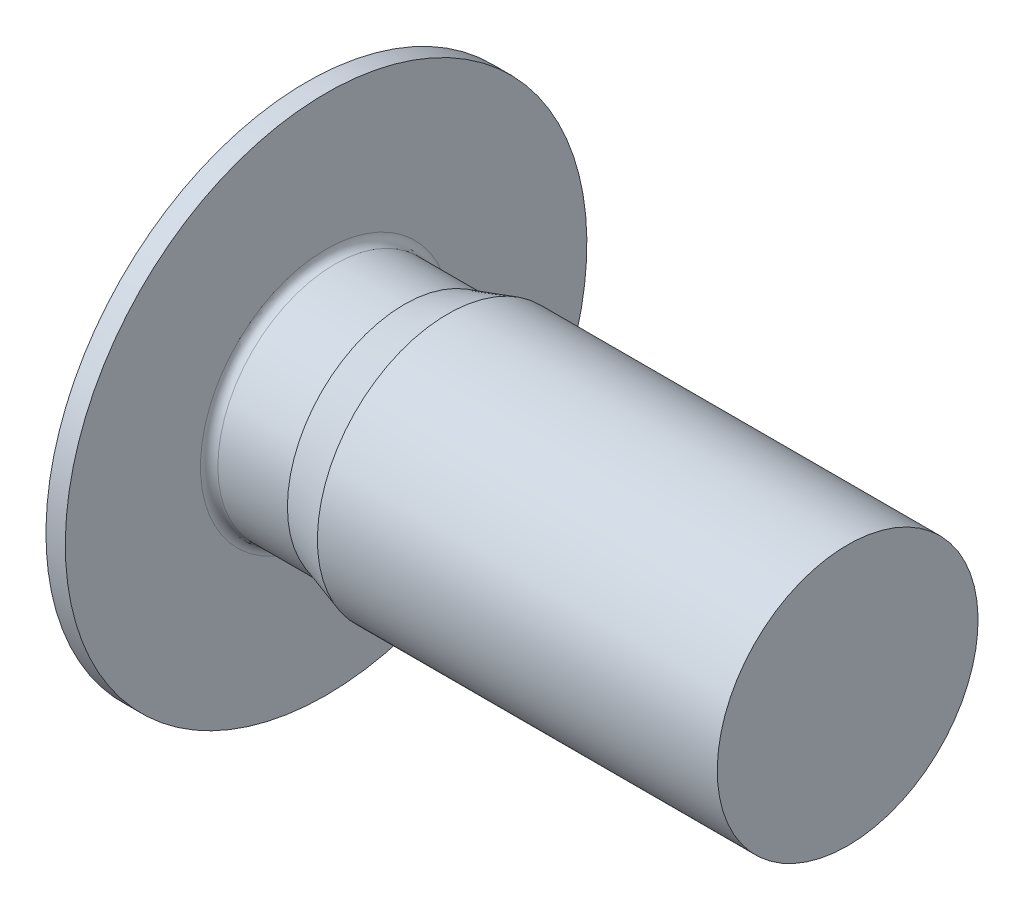
from build123d import *

# Parameters (mm, degrees)
FILLET1_R          = 0.1
CUT_EXTRUDE1_DEPTH = 2


with BuildPart() as part:
    # Sketch1 → Revolve1 (revolve)
    with BuildSketch(Plane.XY):
        Polygon((-0.8, 0), (-0.8, 2), (-0.222649731, 3), (0, 3), (0, 1.345), (0.9, 1.345), (1.4, 1.5), (6, 1.5), (6, 0), align=None)
    revolve(axis=Axis((-0.8, 0, 0), (1, 0, 0)))

    # Fillet1
    fillet1_edges = [part.edges().sort_by_distance(p)[0] for p in [
        (0, -1.345, 0),
    ]]
    fillet(fillet1_edges, radius=FILLET1_R)

    # Sketch2 → Cut-Extrude1 (cut)
    with BuildSketch(Plane.ZY.offset(0.8)):
        Polygon((0, 0.866025404), (-0.75, 0.433012702), (-0.75, -0.433012702), (0, -0.866025404), (0.75, -0.433012702), (0.75, 0.433012702), align=None)
    extrude(amount=-CUT_EXTRUDE1_DEPTH, mode=Mode.SUBTRACT)

    # Sketch3 → Cut-Revolve1 (revolve, cut)
    with BuildSketch(Plane.XY):
        Polygon((1.2, 0), (1.2, 0.75), (1.650645464, 0), align=None)
    revolve(axis=Axis((1.2, 0, 0), (1, 0, 0)), mode=Mode.SUBTRACT)


solid = part.part
